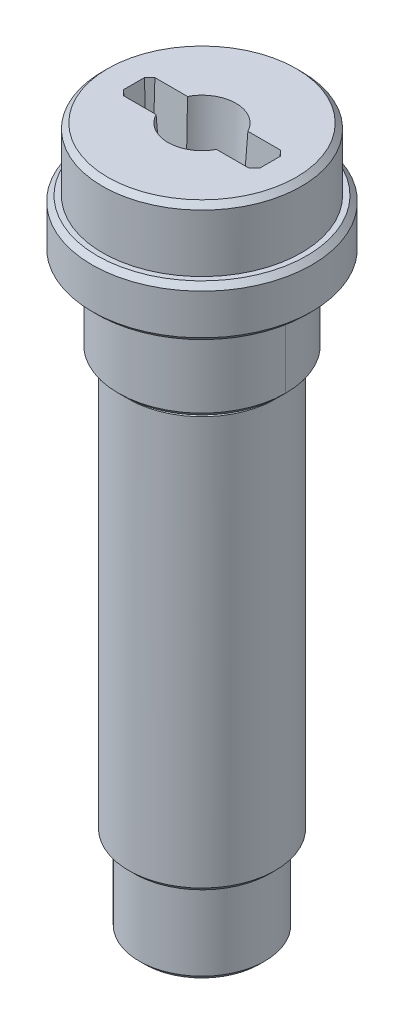
from build123d import *

# Parameters (mm, degrees)
CHAMFER1_SIZE                = 0.5
SKETCH2_R                    = 3.25
CUT_EXTRUDE1_DEPTH           = 6
CUT_EXTRUDE1_DRAFT           = -3
CUT_EXTRUDE1_PROFILE_2_DEPTH = 6
CUT_EXTRUDE1_PROFILE_2_DRAFT = -3
SKETCH3_W                    = 3
SKETCH3_H                    = 8
REVOLVE2_ANGLE               = 180
CHAMFER2_SIZE                = 0.5


with BuildPart() as part:
    # Sketch1 → Revolve1 (revolve)
    with BuildSketch(Plane(origin=(0, 0, 0), x_dir=(0, 0, -1), z_dir=(1, 0, 0))):
        Polygon((0, 1), (0, 66.86), (9.5, 66.86), (9.5, 60.86), (10.5, 60.86), (10.5, 56), (5, 56), (5, 48), (7, 48), (7, 8), (6, 8), (6, 0), (1, 0), align=None)
    revolve(axis=Axis((0, 1, 0), (0, 1, 0)))

    # Chamfer1
    chamfer1_edges = [part.edges().sort_by_distance(p)[0] for p in [
        (0, 0, 6),
        (0, 8, 7),
        (0, 48, 7),
        (0, 56, 10.5),
        (0, 60.86, 10.5),
        (0, 66.86, 9.5),
    ]]
    chamfer(chamfer1_edges, length=CHAMFER1_SIZE)


with BuildPart() as cut_extrude1_tool:
    # Sketch2 → Cut-Extrude1 (with draft: the straight prism first)
    with BuildSketch(Plane(origin=(0, 66.86, 0), x_dir=(1, 0, 0), z_dir=(0, 1, 0))):
        Circle(SKETCH2_R)
    extrude(amount=-CUT_EXTRUDE1_DEPTH)
    # Cut-Extrude1: the draft: its side faces are tilted about the plane it starts from
    cut_extrude1_sides = [cut_extrude1_tool.faces().sort_by_distance(p)[0] for p in [
        (-3.25, 63.86, 0),
    ]]
    draft(cut_extrude1_sides, Plane(origin=(0, 66.86, 0), x_dir=(1, 0, 0), z_dir=(0, 1, 0)), CUT_EXTRUDE1_DRAFT)


with BuildPart() as part_1:
    add(part.part)

    # Cut-Extrude1: cut by cut_extrude1_tool
    add(cut_extrude1_tool.part, mode=Mode.SUBTRACT)


with BuildPart() as cut_extrude1_profile_2_tool:
    # Sketch2 → Cut-Extrude1 profile 2 (with draft: the straight prism first)
    with BuildSketch(Plane(origin=(0, 66.86, 0), x_dir=(1, 0, 0), z_dir=(0, 1, 0))):
        Polygon((-6, 1.5), (-6.5, 1), (-6.5, -1), (-6, -1.5), (6, -1.5), (6.5, -1), (6.5, 1), (6, 1.5), align=None)
    extrude(amount=-CUT_EXTRUDE1_PROFILE_2_DEPTH)
    # Cut-Extrude1 profile 2: the draft: its side faces are tilted about the plane it starts from
    cut_extrude1_profile_2_sides = [cut_extrude1_profile_2_tool.faces().sort_by_distance(p)[0] for p in [
        (-6.25, 63.86, -1.25),
        (-6.5, 63.86, 0),
        (-6.25, 63.86, 1.25),
        (0, 63.86, 1.5),
        (6.25, 63.86, 1.25),
        (6.5, 63.86, 0),
        (6.25, 63.86, -1.25),
        (0, 63.86, -1.5),
    ]]
    draft(cut_extrude1_profile_2_sides, Plane(origin=(0, 66.86, 0), x_dir=(1, 0, 0), z_dir=(0, 1, 0)), CUT_EXTRUDE1_PROFILE_2_DRAFT)


with BuildPart() as part_2:
    add(part_1.part)

    # Cut-Extrude1 profile 2: cut by cut_extrude1_profile_2_tool
    add(cut_extrude1_profile_2_tool.part, mode=Mode.SUBTRACT)


with BuildPart() as body_2:
    # Sketch3 → Revolve2 (revolve)
    with BuildSketch(Plane.XY):
        with Locations((-6.5, 52)):
            Rectangle(SKETCH3_W, SKETCH3_H)
    revolve(axis=Axis((0, 1, 0), (0, -1, 0)), revolution_arc=REVOLVE2_ANGLE)

    # Chamfer2
    chamfer2_edges = [body_2.edges().sort_by_distance(p)[0] for p in [
        (6.5, 56, 0),
        (-6.5, 56, 0),
        (-6.5, 48, 0),
        (0, 56, -8),
        (0, 56, -5),
        (0, 48, -5),
        (0, 48, -8),
        (6.5, 48, 0),
    ]]
    chamfer(chamfer2_edges, length=CHAMFER2_SIZE)


with BuildPart() as body_3:
    # Mirror1: mirrored copy
    add(body_2.part.mirror(Plane.XY))


solid = Compound([part_2.part, body_2.part, body_3.part])
